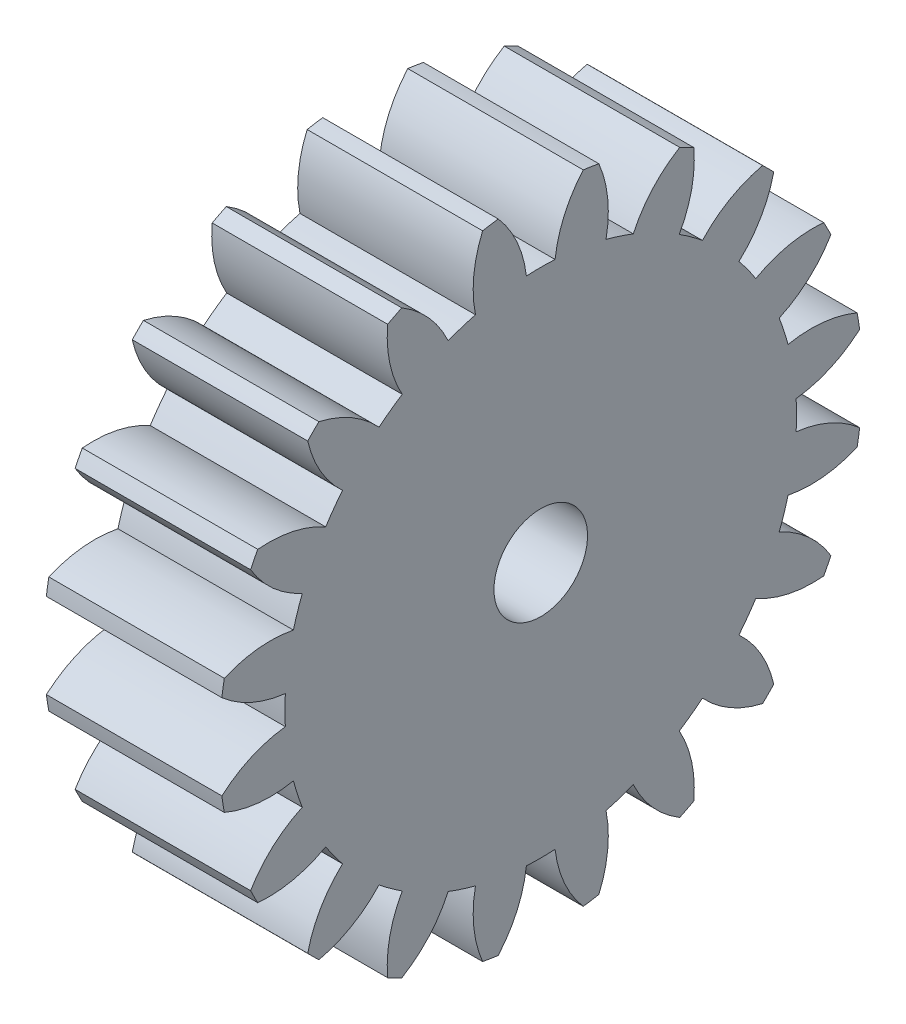
from build123d import *

# Parameters (mm, degrees)
BASPROSKE_W     = 1.5
BASPROSKE_H     = 2.75
TOOTHCUT_DEPTH  = 5.168333
TEETHCUTS_COUNT = 20
TEETHCUTS_ANGLE = 342
BORSKE_R        = 0.4
BORE_DEPTH      = 50.0000508


with BuildPart() as part:
    # BasProSke → Base-Revolve (revolve)
    with BuildSketch(Plane(origin=(0, 0, 0), x_dir=(1, 0, 0), z_dir=(0, 1, 0)), mode=Mode.PRIVATE) as base_revolve_sk:
        with Locations((0.75, 1.375)):
            Rectangle(BASPROSKE_W, BASPROSKE_H)
    revolve(base_revolve_sk.sketch.rotate(Axis((-10, 0, 0), (1, 0, 0)), 180), axis=Axis((-10, 0, 0), (1, 0, 0)))

    # TooCutSke → ToothCut (cut, through all)
    with BuildSketch(Plane(origin=(0, 0, 0), x_dir=(0, 0, -1), z_dir=(1, 0, 0))):
        with BuildLine():
            ThreePointArc((0.12259479, 2.183060413), (0, 2.1865), (-0.12259479, 2.183060413))
            ThreePointArc((-0.12259479, 2.183060413), (-0.208100745, 2.48676384), (-0.383972608, 2.748710642))
            ThreePointArc((-0.383972608, 2.748710642), (0, 2.7754), (0.383972608, 2.748710642))
            ThreePointArc((0.383972608, 2.748710642), (0.208100745, 2.48676384), (0.12259479, 2.183060413))
        make_face()
    toothcut = extrude(amount=TOOTHCUT_DEPTH, mode=Mode.SUBTRACT)

    # TeethCuts: ToothCut ×20 about axis
    teethcuts_axis = Axis((-10, 0, 0), (1, 0, 0))
    for i in range(1, TEETHCUTS_COUNT):
        add(toothcut.rotate(teethcuts_axis, i * TEETHCUTS_ANGLE / (TEETHCUTS_COUNT - 1)), mode=Mode.SUBTRACT)

    # BorSke → Bore (cut, symmetric)
    with BuildSketch(Plane(origin=(0, 0, 0), x_dir=(0, 0, -1), z_dir=(1, 0, 0))):
        with Locations(Location((0, 0, 0), (0, 0, 180))):
            Circle(BORSKE_R)
    extrude(amount=BORE_DEPTH, both=True, mode=Mode.SUBTRACT)


solid = part.part
